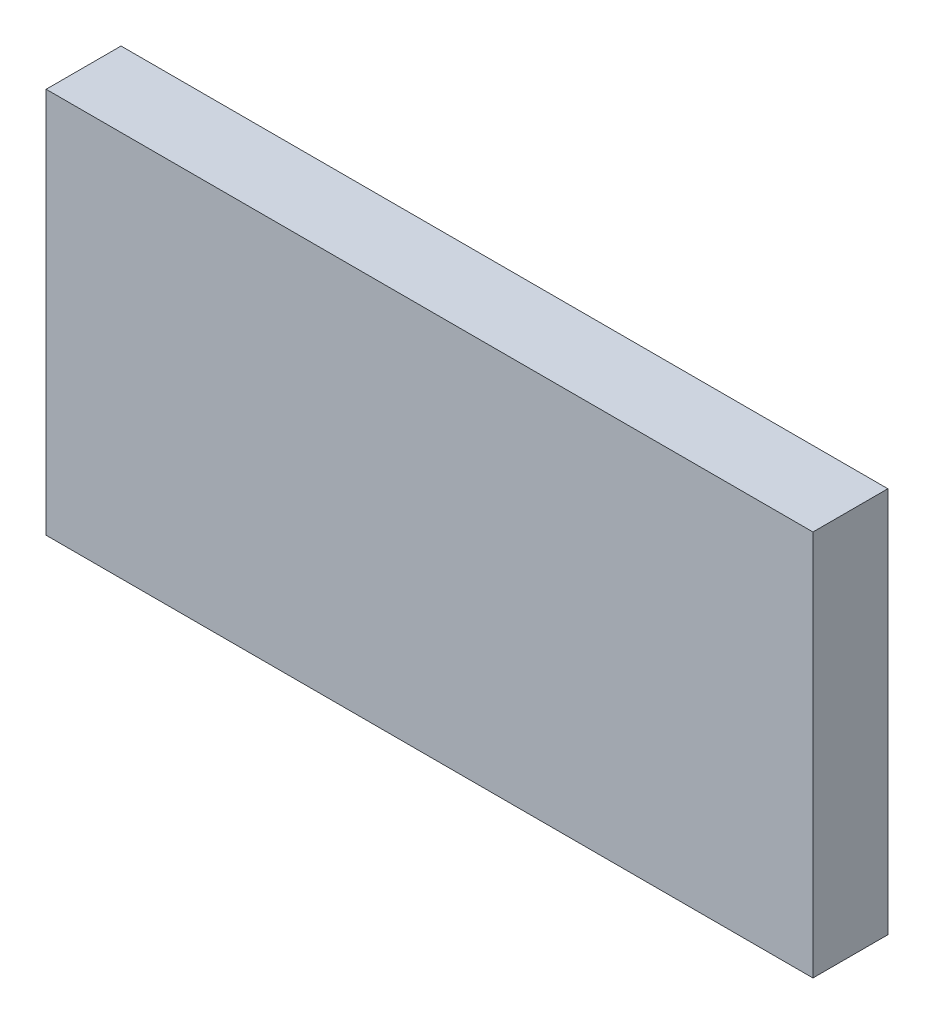
from build123d import *

# Parameters (mm, degrees)
SKIZZE1_W               = 10.2362
SKIZZE1_H               = 5.1562
COMPONENT_OUTLINE_DEPTH = 1


with BuildPart() as part:
    # Skizze1 → Component_Outline (new body)
    with BuildSketch(Plane.XY):
        with Locations((-0.0381, -0.0381)):
            Rectangle(SKIZZE1_W, SKIZZE1_H)
    extrude(amount=COMPONENT_OUTLINE_DEPTH)


solid = part.part
